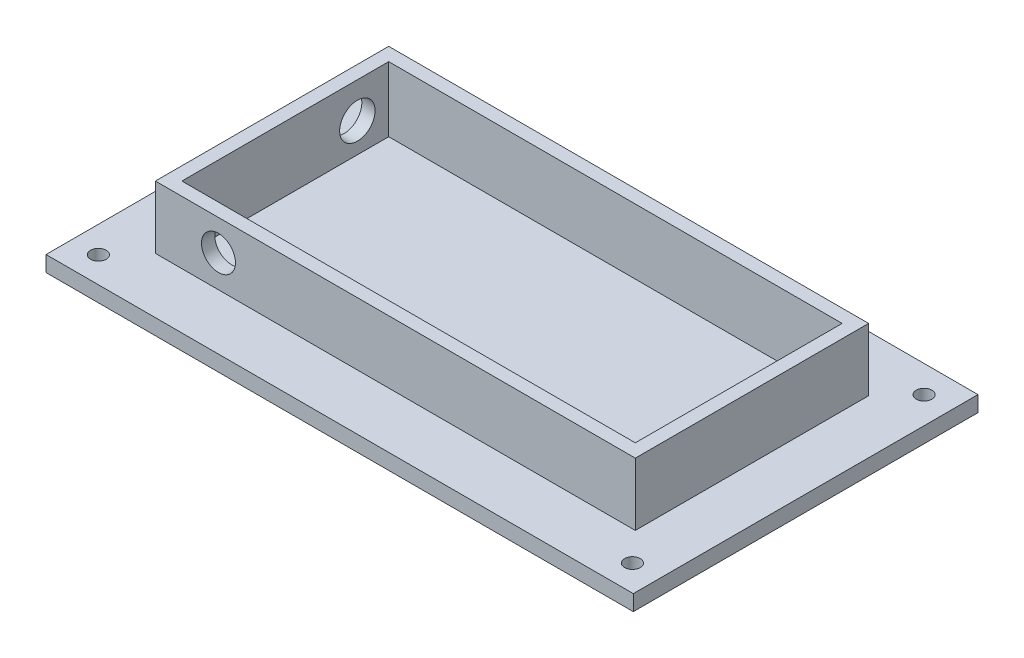
from build123d import *

# Parameters (mm, degrees)
SKETCH1_W           = 112.522
SKETCH1_H           = 66.04
SKETCH1_R           = 1.5
BOSS_EXTRUDE1_DEPTH = 3
SKETCH4_W           = 91.948
SKETCH4_H           = 44.704
BOSS_EXTRUDE2_DEPTH = 12
SHELL1_T            = -2.54
SKETCH13_R          = 3.253406585
CUT_EXTRUDE1_DEPTH  = 8.19
SKETCH15_R          = 3.393829234
CUT_EXTRUDE2_DEPTH  = 8.19
SCALE1_SCALE        = 1.5


with BuildPart() as part:
    # Sketch1 → Boss-Extrude1 (new body)
    with BuildSketch(Plane(origin=(0, 0, 0), x_dir=(1, 0, 0), z_dir=(0, 1, 0))):
        with Locations((4.991983213, -7.115654676)):
            Rectangle(SKETCH1_W, SKETCH1_H)
        with Locations(Location((-46.207741765, 20.726518927, 0), (0, 0, 270))):
            Circle(SKETCH1_R, mode=Mode.SUBTRACT)
        with Locations(Location((56.100367261, 20.726518927, 0), (0, 0, 270))):
            Circle(SKETCH1_R, mode=Mode.SUBTRACT)
        with Locations(Location((56.100367261, -35.155923699, 0), (0, 0, 270))):
            Circle(SKETCH1_R, mode=Mode.SUBTRACT)
        with Locations(Location((-46.207741765, -35.155923699, 0), (0, 0, 270))):
            Circle(SKETCH1_R, mode=Mode.SUBTRACT)
    extrude(amount=BOSS_EXTRUDE1_DEPTH)

    # Sketch4 → Boss-Extrude2 (add)
    with BuildSketch(Plane(origin=(0, 3, 0), x_dir=(1, 0, 0), z_dir=(0, 1, 0))):
        with Locations((4.991983213, -7.115654676)):
            Rectangle(SKETCH4_W, SKETCH4_H)
    extrude(amount=BOSS_EXTRUDE2_DEPTH)

    # Shell1
    shell1_openings = [part.faces().sort_by_distance(p)[0] for p in [
        (4.991983213, 15, 7.115654676),
    ]]
    offset(amount=SHELL1_T, openings=shell1_openings, kind=Kind.INTERSECTION)

    # Sketch13 → Cut-Extrude1 (cut)
    with BuildSketch(Plane.XY.offset(29.467654676)):
        with Locations((-28.892784248, 9.118527178)):
            Circle(SKETCH13_R)
    extrude(amount=-CUT_EXTRUDE1_DEPTH, mode=Mode.SUBTRACT)

    # Sketch15 → Cut-Extrude2 (cut)
    with BuildSketch(Plane.ZY.offset(40.982016787)):
        with Locations((-6.693412029, 8.197427611)):
            Circle(SKETCH15_R)
    extrude(amount=-CUT_EXTRUDE2_DEPTH, mode=Mode.SUBTRACT)


with BuildPart() as part_1:
    # Scale1: scaled about (5.236972756, 3.498136201, 7.097395086)
    add(part.part.scale(SCALE1_SCALE).moved(Location((-2.618486378, -1.7490681, -3.548697543))))


solid = part_1.part
